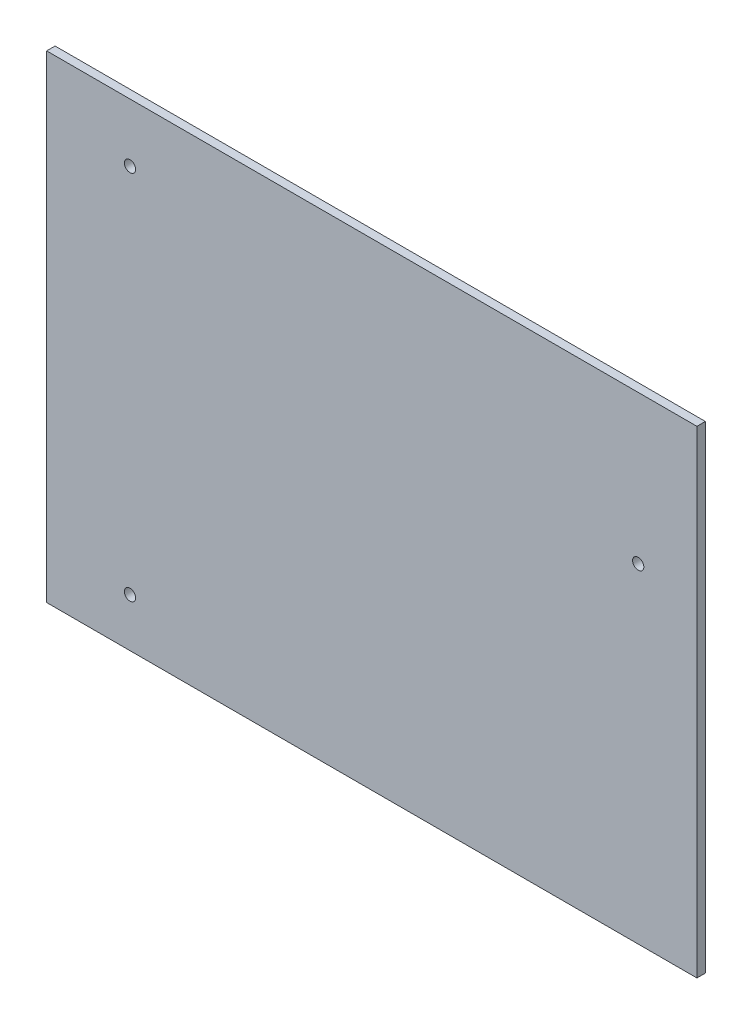
from build123d import *

# Parameters (mm, degrees)
SKETCH5_W           = 231.33970484
SKETCH5_H           = 169.971569924
SKETCH5_R           = 2
BOSS_EXTRUDE1_DEPTH = 3


with BuildPart() as part:
    # Sketch5 → Boss-Extrude1 (new body)
    with BuildSketch(Plane.XY):
        with Locations((121.291098596, 100.611695833)):
            Rectangle(SKETCH5_W, SKETCH5_H)
        with Locations((35.279770561, 164.908609459)):
            Circle(SKETCH5_R, mode=Mode.SUBTRACT)
        with Locations((216.068181509, 132.810408205)):
            Circle(SKETCH5_R, mode=Mode.SUBTRACT)
        with Locations((35.279770561, 32.876853447)):
            Circle(SKETCH5_R, mode=Mode.SUBTRACT)
    extrude(amount=BOSS_EXTRUDE1_DEPTH)


solid = part.part
